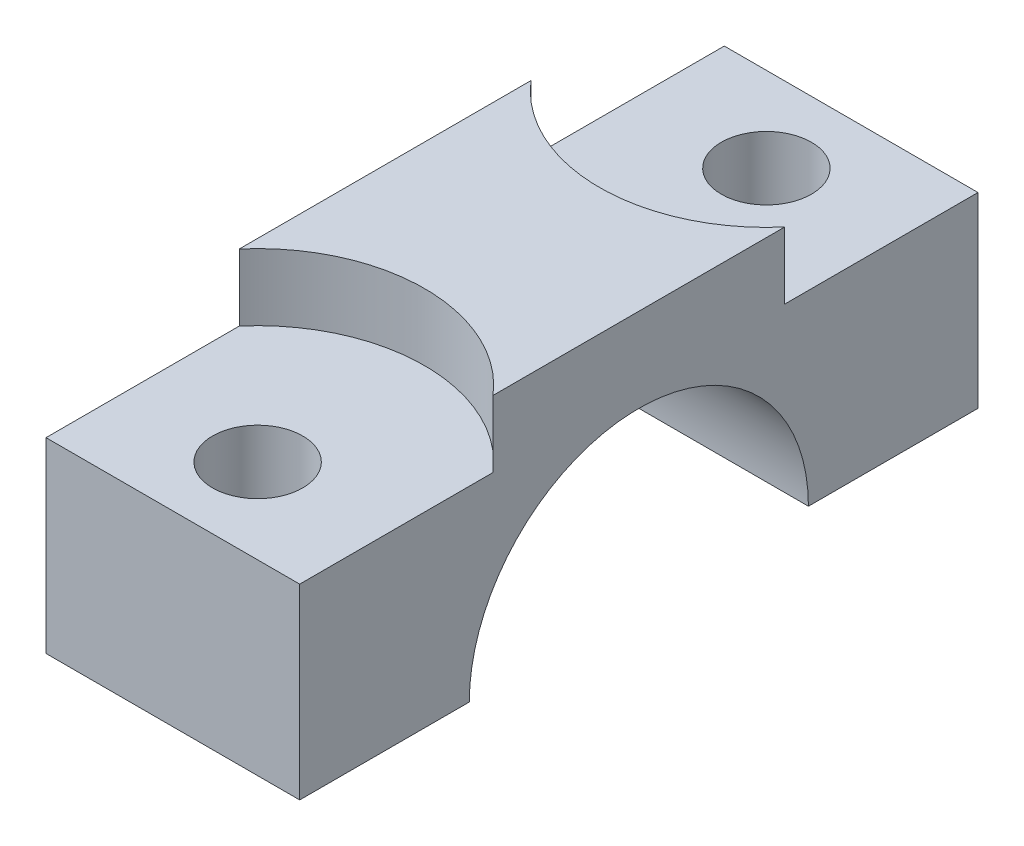
from build123d import *

# Parameters (mm, degrees)
BOSS_EXTRUDE1_DEPTH                           = 9.5
CBORE_FOR_M12_HEX_HEAD_CAP_SCREW1_D           = 6.75
CBORE_FOR_M12_HEX_HEAD_CAP_SCREW1_DEPTH       = 16.51
CBORE_FOR_M12_HEX_HEAD_CAP_SCREW1_CBORE_D     = 25
CBORE_FOR_M12_HEX_HEAD_CAP_SCREW1_CBORE_DEPTH = 5


with BuildPart() as part:
    # Sketch1 → Boss-Extrude1 (new, symmetric)
    with BuildSketch(Plane(origin=(0, 0, 0), x_dir=(0, 0, -1), z_dir=(1, 0, 0))):
        with BuildLine():
            Line((12.7, 0), (25.4, 0))
            Line((25.4, 0), (25.4, 19))
            Line((25.4, 19), (-25.4, 19))
            Line((-25.4, 19), (-25.4, 0))
            Line((-25.4, 0), (-12.7, 0))
            ThreePointArc((-12.7, 0), (0, 12.7), (12.7, 0))
        make_face()
    extrude(amount=BOSS_EXTRUDE1_DEPTH, both=True)

    # CBORE for M12 Hex Head Cap Screw1
    with Locations(Plane(origin=(0, 19, 0), x_dir=(1, 0, 0), z_dir=(0, 1, 0))):
        with Locations((0, 19.05), (0, -19.05)):
            CounterBoreHole(CBORE_FOR_M12_HEX_HEAD_CAP_SCREW1_D / 2, CBORE_FOR_M12_HEX_HEAD_CAP_SCREW1_CBORE_D / 2, CBORE_FOR_M12_HEX_HEAD_CAP_SCREW1_CBORE_DEPTH, depth=CBORE_FOR_M12_HEX_HEAD_CAP_SCREW1_DEPTH)


solid = part.part
